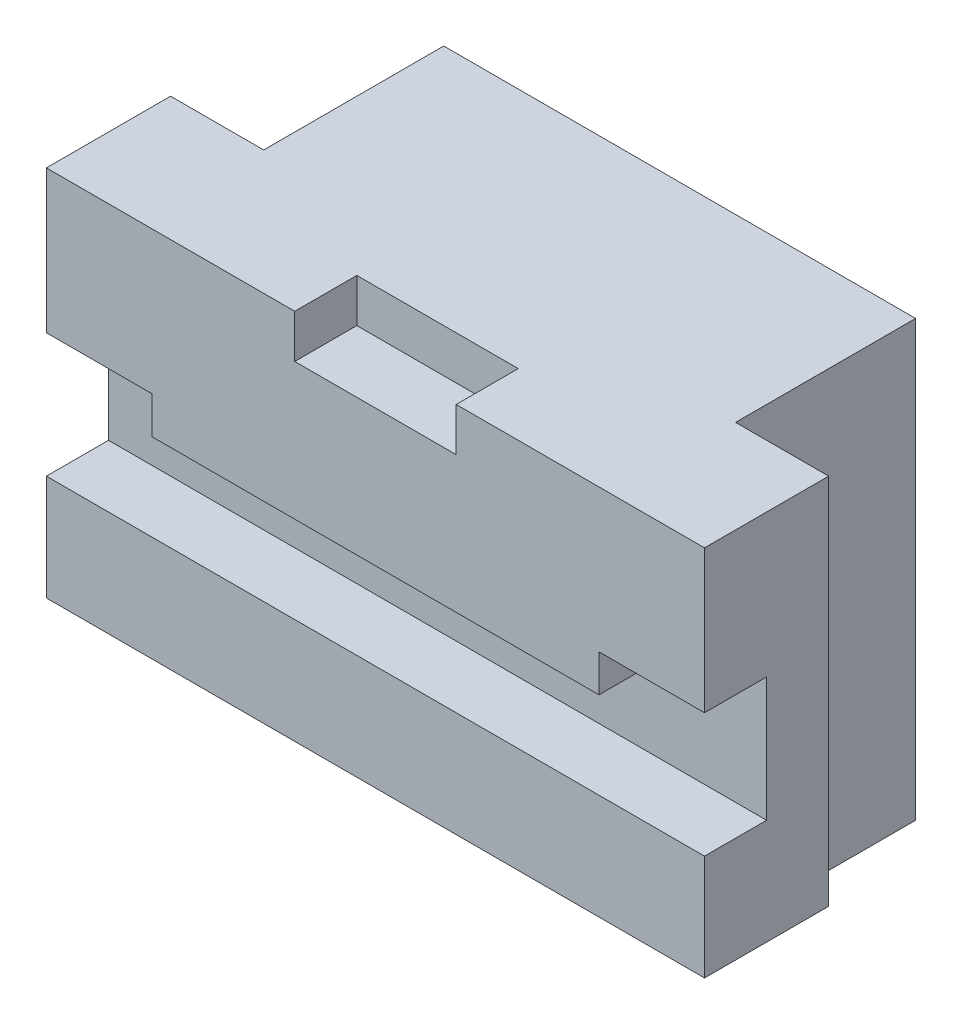
from build123d import *

# Parameters (mm, degrees)
EXTRUDE_1_DEPTH   = 10
EXTRUDE_1_2_DEPTH = 10
EXTRUDE_2_DEPTH   = 10
SKETCH_3_W        = 38
SKETCH_3_H        = 70
EXTRUDE_3_DEPTH   = 9
EXTRUDE_4_DEPTH   = 38
SKETCH_5_W        = 26
SKETCH_5_H        = 7
EXTRUDE_5_DEPTH   = 10
SKETCH_6_W        = 76
SKETCH_6_H        = 70
EXTRUDE_6_DEPTH   = 20


with BuildPart() as part:
    # Эскиз1 → Бобышка-Вытянуть1 (new body)
    with BuildSketch(Plane.XY):
        Polygon((-26.5, 23), (-26.5, 1), (9.5, 1), (9.5, 7), (26.5, 7), (26.5, 30), (-13.5, 30), (-13.5, 23), align=None)
    extrude(amount=EXTRUDE_1_DEPTH)



with BuildPart() as body_2:
    # Эскиз1 → Extrude 1 2 (new body)
    with BuildSketch(Plane.XY):
        Polygon((-26.5, -13), (-26.5, -30), (26.5, -30), (26.5, -13), (9.5, -13), align=None)
    extrude(amount=EXTRUDE_1_2_DEPTH)


with BuildPart() as part_1:
    add(part.part)

    add(body_2.part)  # Бобышка-Вытянуть2 merges body 2
    # Эскиз2 → Бобышка-Вытянуть2 (add)
    with BuildSketch(Plane(origin=(0, 0, 0), x_dir=(-1, 0, 0), z_dir=(0, 0, -1))):
        Polygon((-26.5, -30), (-26.5, 30), (13.5, 30), (13.5, 23), (26.5, 23), (26.5, -30), align=None)
    extrude(amount=EXTRUDE_2_DEPTH)

    # Эскиз3 → Бобышка-Вытянуть3 (add)
    with BuildSketch(Plane(origin=(0, 0, -10), x_dir=(-1, 0, 0), z_dir=(0, 0, -1))):
        with Locations((7.5, -5)):
            Rectangle(SKETCH_3_W, SKETCH_3_H)
    extrude(amount=EXTRUDE_3_DEPTH)

    # Эскиз4 → Бобышка-Вытянуть4 (add)
    with BuildSketch(Plane(origin=(11.5, 0, 0), x_dir=(0, 0, -1), z_dir=(1, 0, 0))):
        Polygon((10, -40), (-10, -30), (10, -30), align=None)
    extrude(amount=-EXTRUDE_4_DEPTH)

    # Зеркальное отражение1: part across plane


with BuildPart() as part_2:
    add(part_1.part)
    add(part_1.part.mirror(Plane(origin=(-26.5, 0, 10), x_dir=(0, 0, 1), z_dir=(-1, 0, 0))))

    # Эскиз5 → Бобышка-Вытянуть5 (add)
    with BuildSketch(Plane.XY.offset(-10)):
        with Locations((-26.5, 26.5)):
            Rectangle(SKETCH_5_W, SKETCH_5_H)
    extrude(amount=EXTRUDE_5_DEPTH)

    # Эскиз6 → Бобышка-Вытянуть6 (add)
    with BuildSketch(Plane(origin=(0, 0, -19), x_dir=(-1, 0, 0), z_dir=(0, 0, -1))):
        with Locations((26.5, -5)):
            Rectangle(SKETCH_6_W, SKETCH_6_H)
    extrude(amount=EXTRUDE_6_DEPTH)


solid = part_2.part
